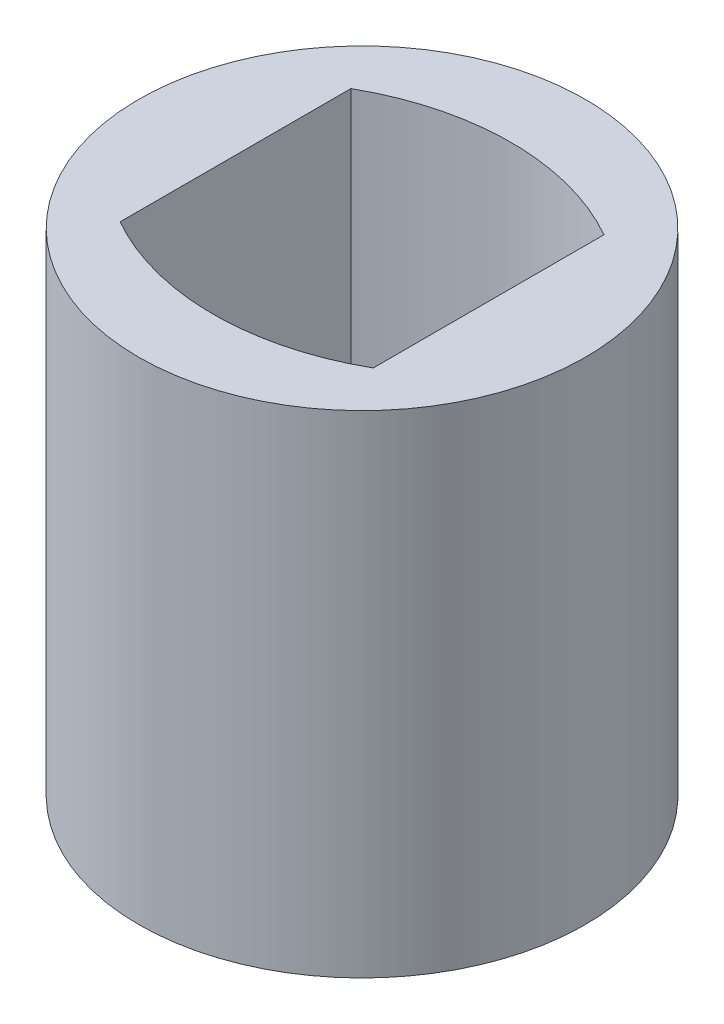
from build123d import *

# Parameters (mm, degrees)
SKETCH2_R           = 3.81
BOSS_EXTRUDE1_DEPTH = 1.27
BOSS_EXTRUDE2_DEPTH = 1.27
BOSS_EXTRUDE3_START = 5.842
SKETCH4_R           = 3.81
BOSS_EXTRUDE3_DEPTH = 5.842


with BuildPart() as part:
    # Sketch2 → Boss-Extrude1 (new, symmetric)
    with BuildSketch(Plane(origin=(0, 0, 0), x_dir=(1, 0, 0), z_dir=(0, 1, 0))):
        with Locations(Location((0, 0, 0), (0, 0, 270))):
            Circle(SKETCH2_R)
    extrude(amount=BOSS_EXTRUDE1_DEPTH, both=True)

    # Sketch3 → Boss-Extrude2 (add)
    with BuildSketch(Plane.XZ.offset(1.27)):
        with BuildLine():
            Line((-0.889, 1.0922), (-0.889, -1.0922))
            ThreePointArc((-0.889, -1.0922), (0, -1.397), (0.889, -1.0922))
            Line((0.889, -1.0922), (0.889, 1.0922))
            ThreePointArc((0.889, 1.0922), (0, 1.397), (-0.889, 1.0922))
        make_face()
    extrude(amount=BOSS_EXTRUDE2_DEPTH)

    # Sketch4 → Boss-Extrude3 (add)
    with BuildSketch(Plane(origin=(0, 1.27, 0), x_dir=(1, 0, 0), z_dir=(0, 1, 0)).offset(BOSS_EXTRUDE3_START)):
        with Locations(Location((0, 0, 0), (0, 0, 270))):
            Circle(SKETCH4_R)
        with BuildLine():
            Line((-2.159, 1.9685), (-2.159, -1.9685))
            ThreePointArc((-2.159, -1.9685), (0, -2.54), (2.159, -1.9685))
            Line((2.159, -1.9685), (2.159, 1.9685))
            ThreePointArc((2.159, 1.9685), (0, 2.54), (-2.159, 1.9685))
        make_face(mode=Mode.SUBTRACT)
    extrude(amount=-BOSS_EXTRUDE3_DEPTH)


solid = part.part
